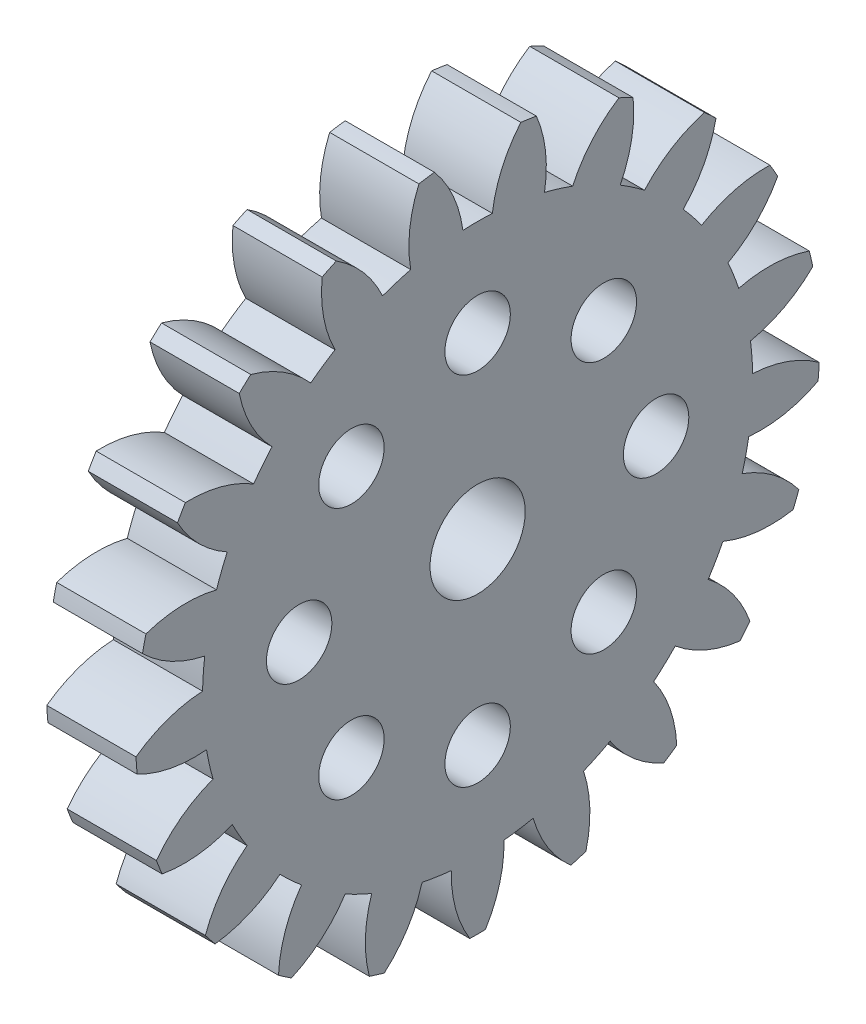
from build123d import *

# Parameters (mm, degrees)
BASPROSKE_W         = 3
BASPROSKE_H         = 11.5
TOOTHCUT_DEPTH      = 17.537835409
TEETHCUTS_COUNT     = 21
TEETHCUTS_ANGLE     = 342.857142857
BORSKE_R            = 4
BORE_DEPTH          = 50.0000508
EXTRUDE_START       = -3
SKETCH_1_R          = 4
EXTRUDE_1_DEPTH     = 3
SKETCH_2_R          = 1.6
SKETCH_2_R_2        = 1.1
CUT_EXTRUDE_1_DEPTH = 17.52708436


with BuildPart() as part:
    # BasProSke → Base-Revolve (revolve)
    with BuildSketch(Plane(origin=(0, 0, 0), x_dir=(1, 0, 0), z_dir=(0, 1, 0)), mode=Mode.PRIVATE) as base_revolve_sk:
        with Locations((1.5, 5.75)):
            Rectangle(BASPROSKE_W, BASPROSKE_H)
    revolve(base_revolve_sk.sketch.rotate(Axis((-10, 0, 0), (1, 0, 0)), 180), axis=Axis((-10, 0, 0), (1, 0, 0)))

    # TooCutSke → ToothCut (cut, through all)
    with BuildSketch(Plane(origin=(0, 0, 0), x_dir=(0, 0, -1), z_dir=(1, 0, 0))):
        with BuildLine():
            ThreePointArc((0.49526894, 9.235730057), (0, 9.249), (-0.49526894, 9.235730057))
            ThreePointArc((-0.49526894, 9.235730057), (-0.823521057, 10.404716786), (-1.472455249, 11.430954496))
            ThreePointArc((-1.472455249, 11.430954496), (0, 11.5254), (1.472455249, 11.430954496))
            ThreePointArc((1.472455249, 11.430954496), (0.823521057, 10.404716786), (0.49526894, 9.235730057))
        make_face()
    toothcut = extrude(amount=TOOTHCUT_DEPTH, mode=Mode.SUBTRACT)

    # TeethCuts: ToothCut ×21 about axis
    teethcuts_axis = Axis((-10, 0, 0), (1, 0, 0))
    for i in range(1, TEETHCUTS_COUNT):
        add(toothcut.rotate(teethcuts_axis, i * TEETHCUTS_ANGLE / (TEETHCUTS_COUNT - 1)), mode=Mode.SUBTRACT)

    # BorSke → Bore (cut, symmetric)
    with BuildSketch(Plane(origin=(0, 0, 0), x_dir=(0, 0, -1), z_dir=(1, 0, 0))):
        with Locations(Location((0, 0, 0), (0, 0, 180))):
            Circle(BORSKE_R)
    extrude(amount=BORE_DEPTH, both=True, mode=Mode.SUBTRACT)

    # ｽｹｯﾁ1 → ﾎﾞｽ - 押し出し1 (add)
    with BuildSketch(Plane.ZY.offset(EXTRUDE_START)):
        Circle(SKETCH_1_R)
    extrude(amount=EXTRUDE_1_DEPTH)

    # ｽｹｯﾁ2 → ｶｯﾄ - 押し出し1 (cut, through all)
    with BuildSketch(Plane(origin=(3, 0, 0), x_dir=(0, 0, -1), z_dir=(1, 0, 0))):
        Circle(SKETCH_2_R)
        with Locations((6, 0)):
            Circle(SKETCH_2_R_2)
        with Locations((4.242640687, -4.242640687)):
            Circle(SKETCH_2_R_2)
        with Locations((0, -6)):
            Circle(SKETCH_2_R_2)
        with Locations((-4.242640687, -4.242640687)):
            Circle(SKETCH_2_R_2)
        with Locations((-6, 0)):
            Circle(SKETCH_2_R_2)
        with Locations((-4.242640687, 4.242640687)):
            Circle(SKETCH_2_R_2)
        with Locations((0, 6)):
            Circle(SKETCH_2_R_2)
        with Locations((4.242640687, 4.242640687)):
            Circle(SKETCH_2_R_2)
    extrude(amount=-CUT_EXTRUDE_1_DEPTH, mode=Mode.SUBTRACT)


solid = part.part
